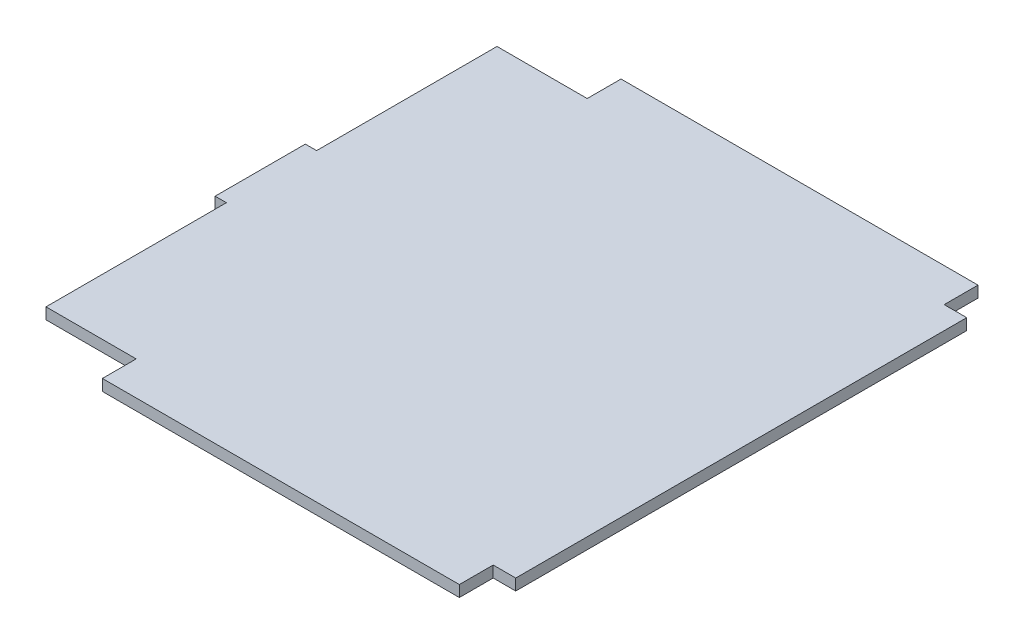
from build123d import *

# Parameters (mm, degrees)
BOSS_EXTRUDE1_DEPTH = 3.175


with BuildPart() as part:
    # Sketch1 → Boss-Extrude1 (new body)
    with BuildSketch(Plane(origin=(0, 0, 0), x_dir=(1, 0, 0), z_dir=(0, 1, 0))):
        Polygon((-40.736256602, -73.025), (59.786256602, -73.025), (59.786256602, -63.5), (66.136256602, -63.5), (66.136256602, 63.5), (59.786256602, 63.5), (59.786256602, 73.025), (-40.736256602, 73.025), (-40.736256602, 63.5), (-66.136256602, 63.5), (-66.136256602, 12.7), (-69.311256602, 12.7), (-69.311256602, -12.7), (-66.136256602, -12.7), (-66.136256602, -63.5), (-40.736256602, -63.5), align=None)
    extrude(amount=BOSS_EXTRUDE1_DEPTH)


solid = part.part
